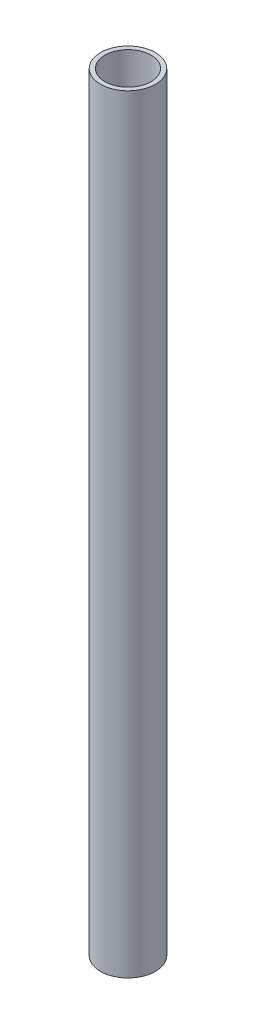
from build123d import *

# Parameters (mm, degrees)
SKETCH1_R           = 12.5
SKETCH1_R_2         = 10.5
BOSS_EXTRUDE1_DEPTH = 350


with BuildPart() as part:
    # Sketch1 → Boss-Extrude1 (new body)
    with BuildSketch(Plane(origin=(0, 0, 0), x_dir=(1, 0, 0), z_dir=(0, 1, 0))):
        with Locations(Location((0, 0, 0), (0, 0, 270))):
            Circle(SKETCH1_R)
        with Locations(Location((0, 0, 0), (0, 0, 270))):
            Circle(SKETCH1_R_2, mode=Mode.SUBTRACT)
    extrude(amount=BOSS_EXTRUDE1_DEPTH)


solid = part.part
